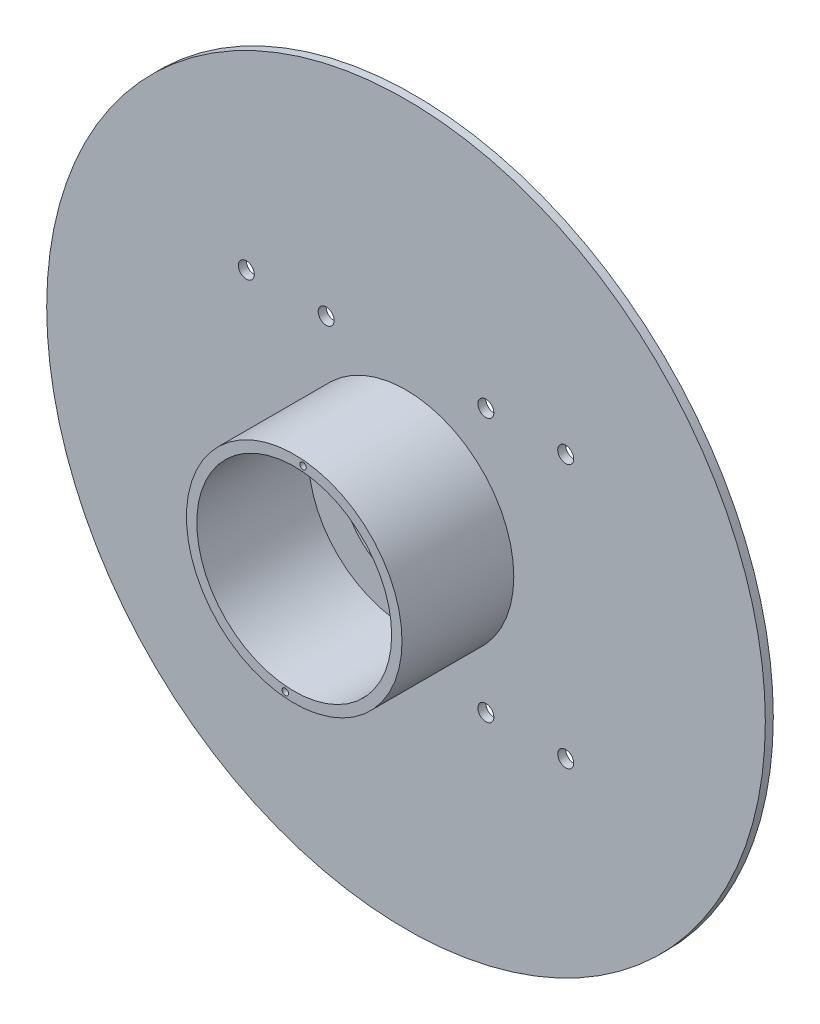
from build123d import *

# Parameters (mm, degrees)
SKETCH_1_R          = 45
EXTRUDE_1_DEPTH     = 1
SKETCH_2_R          = 1
CUT_EXTRUDE_1_DEPTH = 64.647466564
SKETCH_3_R          = 13.5
SKETCH_3_R_2        = 12.2
EXTRUDE_2_DEPTH     = 6
SKETCH_4_R          = 4
CUT_EXTRUDE_2_DEPTH = 64.921827258
SKETCH_5_R          = 8
CUT_EXTRUDE_3_DEPTH = 10
SKETCH_6_R          = 13.5
SKETCH_6_R_2        = 12.2
EXTRUDE_3_DEPTH     = 8
SKETCH_7_R          = 0.4
CUT_EXTRUDE_4_DEPTH = 2.8


with BuildPart() as part:
    # 草图1 → 凸台-拉伸1 (new body)
    with BuildSketch(Plane.XY):
        Circle(SKETCH_1_R)
    extrude(amount=EXTRUDE_1_DEPTH)

    # 草图2 → 切除-拉伸1 (cut, through all)
    with BuildSketch(Plane.XY.offset(1)):
        with Locations((20, -16.5)):
            Circle(SKETCH_2_R)
        with Locations((20, 16.5)):
            Circle(SKETCH_2_R)
        with Locations((-20, 16.5)):
            Circle(SKETCH_2_R)
        with Locations((-20, -16.5)):
            Circle(SKETCH_2_R)
        with Locations((10, -16.5)):
            Circle(SKETCH_2_R)
        with Locations((10, 16.5)):
            Circle(SKETCH_2_R)
        with Locations((-10, 16.5)):
            Circle(SKETCH_2_R)
        with Locations((-10, -16.5)):
            Circle(SKETCH_2_R)
    extrude(amount=-CUT_EXTRUDE_1_DEPTH, mode=Mode.SUBTRACT)

    # 草图3 → 凸台-拉伸2 (add)
    with BuildSketch(Plane.XY.offset(1)):
        Circle(SKETCH_3_R)
        Circle(SKETCH_3_R_2, mode=Mode.SUBTRACT)
    extrude(amount=EXTRUDE_2_DEPTH)

    # 草图4 → 切除-拉伸2 (cut, through all)
    with BuildSketch(Plane.XY.offset(1)):
        Circle(SKETCH_4_R)
    extrude(amount=-CUT_EXTRUDE_2_DEPTH, mode=Mode.SUBTRACT)

    # 草图5 → 切除-拉伸3 (cut)
    with BuildSketch(Plane.XY.offset(1)):
        Circle(SKETCH_5_R)
    extrude(amount=-CUT_EXTRUDE_3_DEPTH, mode=Mode.SUBTRACT)

    # 草图6 → 凸台-拉伸3 (add)
    with BuildSketch(Plane.XY.offset(7)):
        Circle(SKETCH_6_R)
        Circle(SKETCH_6_R_2, mode=Mode.SUBTRACT)
    extrude(amount=EXTRUDE_3_DEPTH)

    # 草图7 → 切除-拉伸4 (cut)
    with BuildSketch(Plane(origin=(65.728441972, -2.343791879, 15), x_dir=(0.9999857974272592, -0.005329628858411386, 0), z_dir=(0, 0, 1))):
        with Locations(Location((-64.698660153, 14.801186776, 0), (0, 0, 0.305366686))):
            Circle(SKETCH_7_R)
        with Locations(Location((-66.781339847, -10.814285995, 0), (0, 0, 0.305366686))):
            Circle(SKETCH_7_R)
    extrude(amount=-CUT_EXTRUDE_4_DEPTH, mode=Mode.SUBTRACT)


solid = part.part
